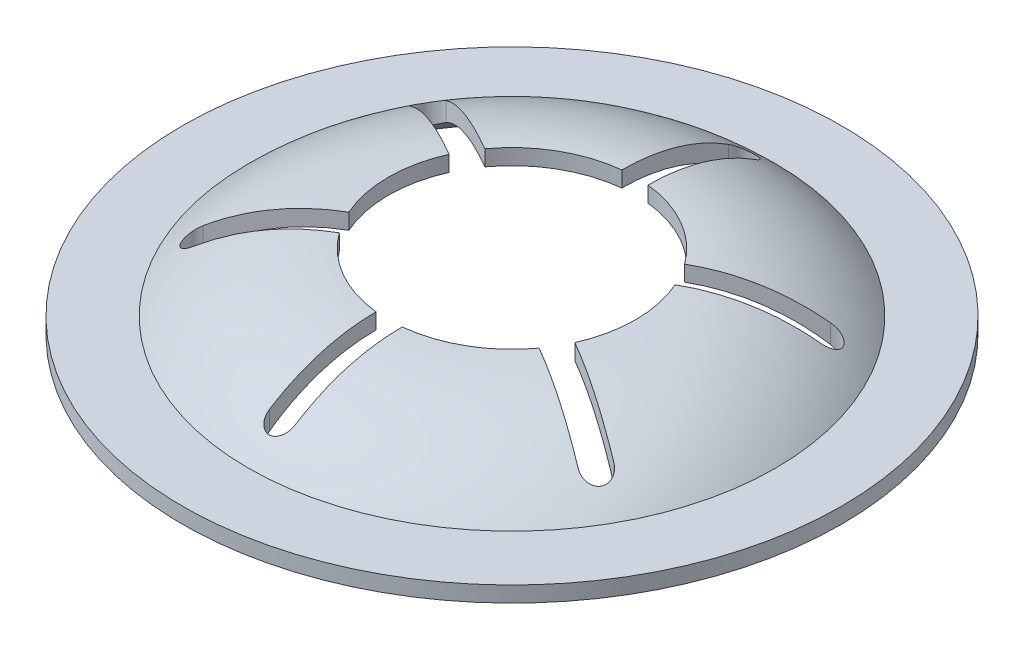
from build123d import *

# Parameters (mm, degrees)
CUT_EXTRUDE1_DEPTH = 12.456002809
CIRPATTERN1_COUNT  = 6


with BuildPart() as part:
    # Sketch2 → Revolve1 (revolve)
    with BuildSketch(Plane.XY, mode=Mode.PRIVATE) as revolve1_sk:
        with BuildLine():
            Line((-8, 0), (-6.237085417, 0))
            ThreePointArc((-6.237085417, 0), (-4.767221194, 1.048671922), (-3, 1.419))
            Line((-3, 1.419), (-3, 1.8))
            ThreePointArc((-3, 1.8), (-4.842115699, 1.431016827), (-6.4, 0.381))
            Line((-6.4, 0.381), (-8, 0.381))
            Line((-8, 0.381), (-8, 0))
        make_face()
    revolve(revolve1_sk.sketch.rotate(Axis((0, 0, 0), (0, 1, 0)), 180), axis=Axis((0, 0, 0), (0, 1, 0)))

    # Sketch3 → Cut-Extrude1 (cut, through all)
    with BuildSketch(Plane(origin=(0, 0, 0), x_dir=(1, 0, 0), z_dir=(0, 1, 0))):
        with BuildLine():
            Line((-0.3175, 5.5745), (-0.3175, 0))
            Line((-0.3175, 0), (0.3175, 0))
            Line((0.3175, 0), (0.3175, 5.5745))
            ThreePointArc((0.3175, 5.5745), (0, 5.892), (-0.3175, 5.5745))
        make_face()
    cut_extrude1 = extrude(amount=CUT_EXTRUDE1_DEPTH, mode=Mode.SUBTRACT)

    # CirPattern1: Cut-Extrude1 ×6 about axis
    cirpattern1_axis = Axis((0, 0, 0), (0, 1, 0))
    for i in range(1, CIRPATTERN1_COUNT):
        add(cut_extrude1.rotate(cirpattern1_axis, i * 360 / CIRPATTERN1_COUNT), mode=Mode.SUBTRACT)


solid = part.part
